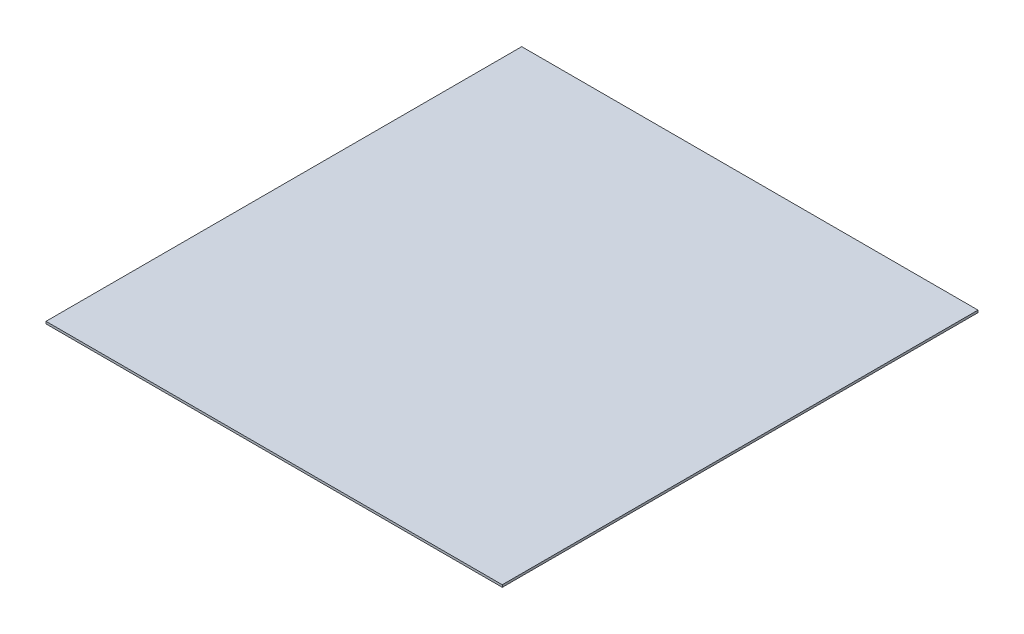
from build123d import *

# Parameters (mm, degrees)
SKETCH1_W           = 352
SKETCH1_H           = 367
BOSS_EXTRUDE1_DEPTH = 1.75
SKETCH2_W           = 162
SKETCH2_H           = 1.75
BOSS_EXTRUDE3_DEPTH = 30


with BuildPart() as part:
    # Sketch1 → Boss-Extrude1 (new body)
    with BuildSketch(Plane(origin=(0, 0, 0), x_dir=(1, 0, 0), z_dir=(0, 1, 0))):
        Rectangle(SKETCH1_W, SKETCH1_H)
    extrude(amount=BOSS_EXTRUDE1_DEPTH)

    # Sketch2 → Boss-Extrude3 (add)
    with BuildSketch(Plane.XZ):
        with Locations((-95, -182.625)):
            Rectangle(SKETCH2_W, SKETCH2_H)
    extrude(amount=BOSS_EXTRUDE3_DEPTH)


solid = part.part
